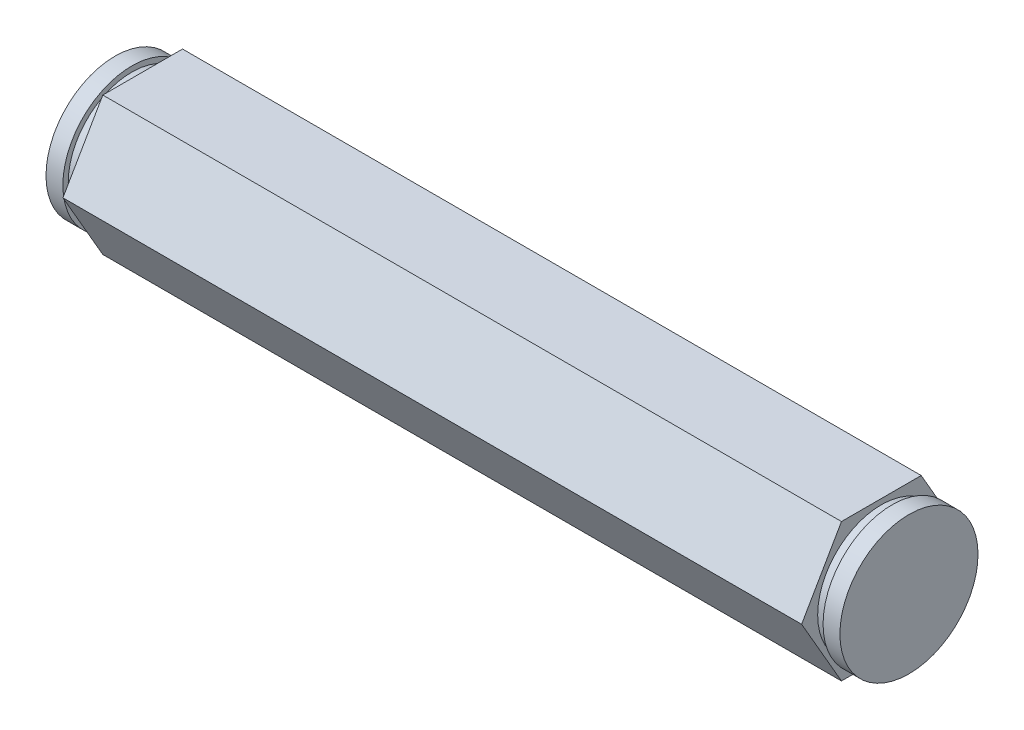
from build123d import *

# Parameters (mm, degrees)
BOSS_EXTRUDE1_DEPTH = 36.50750001


with BuildPart() as part:
    # Sketch1 → Boss-Extrude1 (new, symmetric)
    with BuildSketch(Plane(origin=(0, 0, 0), x_dir=(0, 0, -1), z_dir=(1, 0, 0))):
        Polygon((7.332348419, 0), (3.666174209, 6.35), (-3.666174209, 6.35), (-7.332348419, 0), (-3.666174209, -6.35), (3.666174209, -6.35), align=None)
    extrude(amount=BOSS_EXTRUDE1_DEPTH, both=True)

    # Sketch2 → Cut-Revolve1 (revolve, cut)
    with BuildSketch(Plane(origin=(0, 0, 0), x_dir=(1, 0, 0), z_dir=(0, 1, 0))):
        Polygon((33.96750001, -5.8547), (34.95810001, -5.8547), (34.95810001, -6.35), (36.50750001, -6.35), (36.50750001, -8.89), (33.96750001, -8.89), align=None)
    cut_revolve1 = revolve(axis=Axis((0, 0, 0), (1, 0, 0)), mode=Mode.SUBTRACT)

    # Mirror1: Cut-Revolve1 across plane
    add(cut_revolve1.mirror(Plane(origin=(0, 0, 0), x_dir=(0, 0, 1), z_dir=(1, 0, 0))), mode=Mode.SUBTRACT)


solid = part.part
